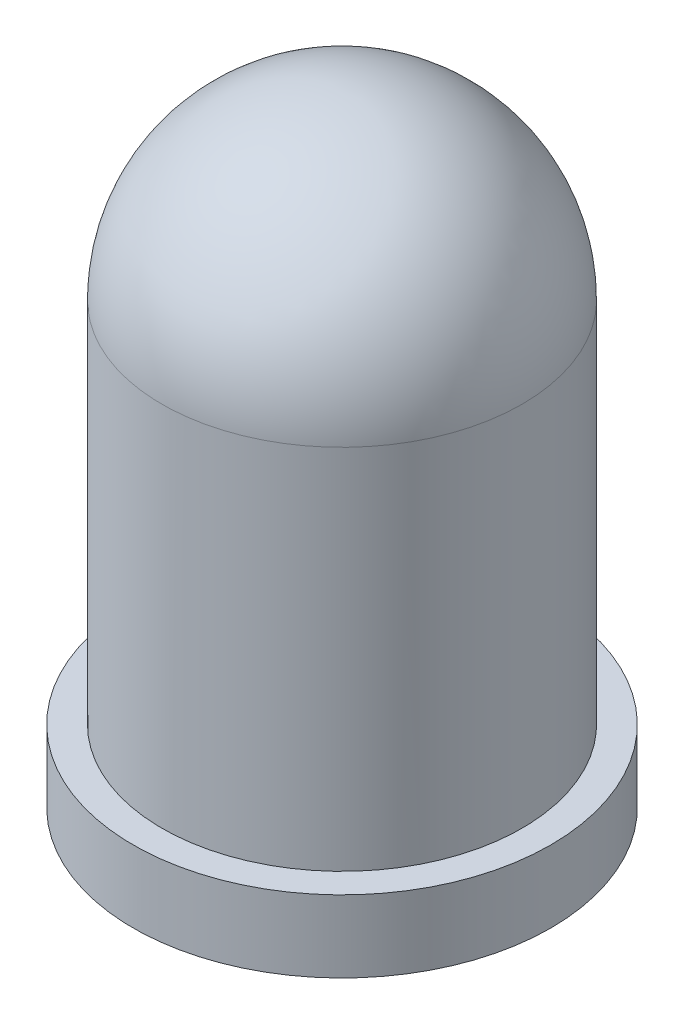
from build123d import *


with BuildPart() as part:
    # Эскиз1 → Повернуть1 (revolve)
    with BuildSketch(Plane.XY, mode=Mode.PRIVATE) as revolve_1_sk:
        with BuildLine():
            Line((0, 8.6), (0, 0))
            Line((0, 0), (2.9, 0))
            Line((2.9, 0), (2.9, 1))
            Line((2.9, 1), (2.5, 1))
            Line((2.5, 1), (2.5, 6.1))
            ThreePointArc((2.5, 6.1), (1.767766953, 7.867766953), (0, 8.6))
        make_face()
    revolve(revolve_1_sk.sketch.rotate(Axis((0, 8.6, 0), (0, -1, 0)), 180), axis=Axis((0, 8.6, 0), (0, -1, 0)))


solid = part.part
